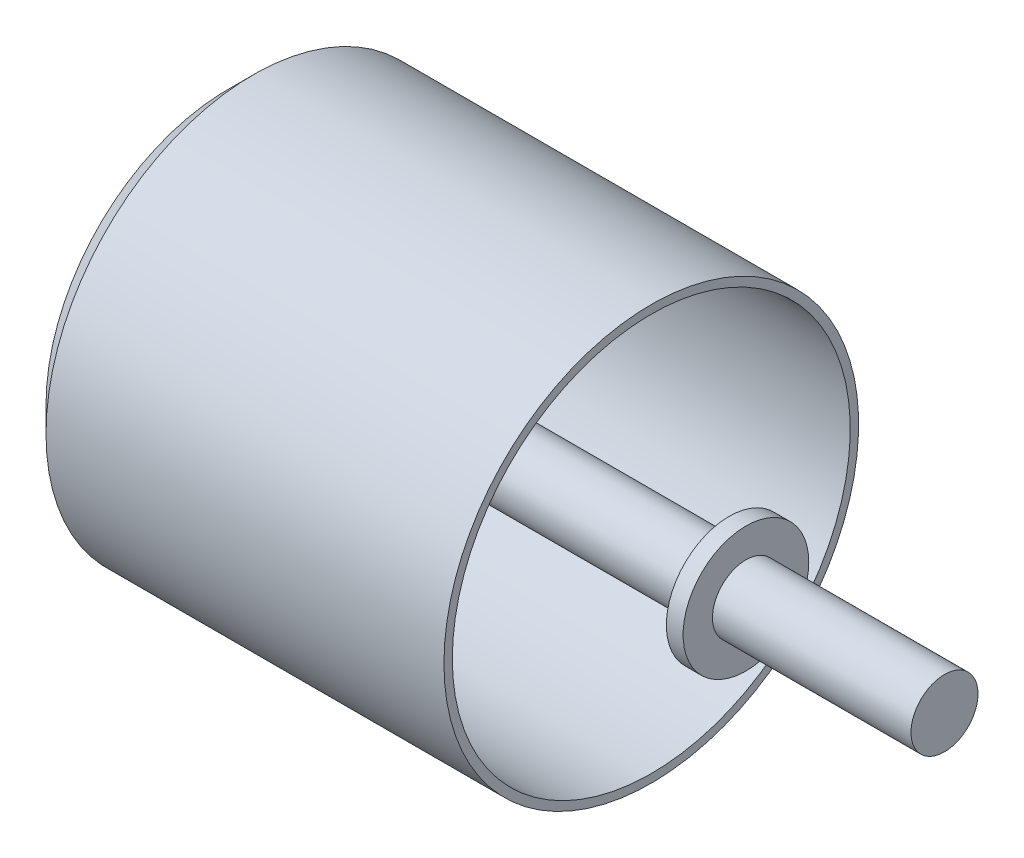
from build123d import *

# Parameters (mm, degrees)
SKETCH2_R           = 4
BOSS_EXTRUDE1_DEPTH = 85.5
SKETCH3_R           = 3.5
CUT_EXTRUDE1_DEPTH  = 93.387093254
SKETCH4_R           = 7.5
BOSS_EXTRUDE2_DEPTH = 2


with BuildPart() as part:
    # Sketch1 → Revolve1 (revolve)
    with BuildSketch(Plane.XY, mode=Mode.PRIVATE) as revolve1_sk:
        Polygon((0, 21.75), (3, 24.75), (50.5, 24.75), (50.5, 23.75), (3.414213562, 23.75), (1, 21.335786438), (1, 0), (0, 0), align=None)
    revolve(revolve1_sk.sketch.rotate(Axis((0, 0, 0), (1, 0, 0)), 90), axis=Axis((0, 0, 0), (1, 0, 0)))

    # Sketch2 → Boss-Extrude1 (add)
    with BuildSketch(Plane(origin=(0, 0, 0), x_dir=(0, 0, -1), z_dir=(1, 0, 0))):
        with Locations(Location((0, 0, 0), (0, 0, 180))):
            Circle(SKETCH2_R)
    extrude(amount=BOSS_EXTRUDE1_DEPTH)

    # Sketch3 → Cut-Extrude1 (cut, through all)
    with BuildSketch(Plane.ZY):
        with Locations((0, 17)):
            Circle(SKETCH3_R)
        with Locations((17, 0)):
            Circle(SKETCH3_R)
        with Locations((0, -17)):
            Circle(SKETCH3_R)
        with Locations((-17, 0)):
            Circle(SKETCH3_R)
    extrude(amount=-CUT_EXTRUDE1_DEPTH, mode=Mode.SUBTRACT)

    # Sketch4 → Boss-Extrude2 (add)
    with BuildSketch(Plane(origin=(59.8, 0, 0), x_dir=(0, 0, -1), z_dir=(1, 0, 0))):
        Circle(SKETCH4_R)
    extrude(amount=BOSS_EXTRUDE2_DEPTH)


solid = part.part
